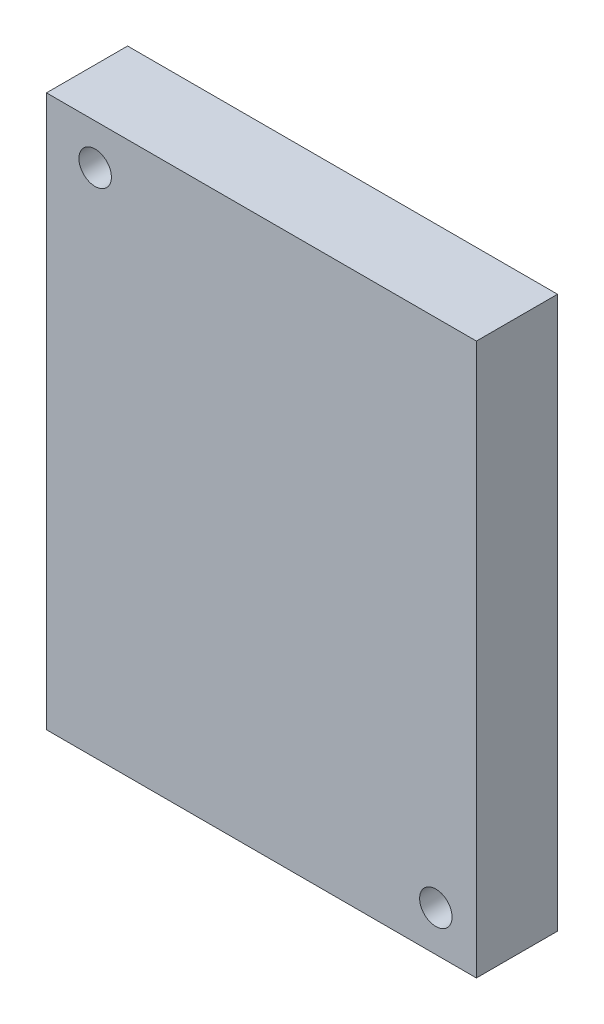
from build123d import *

# Parameters (mm, degrees)
SKETCH1_W           = 26.5
SKETCH1_H           = 34
SKETCH1_R           = 1
BOSS_EXTRUDE1_DEPTH = 5


with BuildPart() as part:
    # Sketch1 → Boss-Extrude1 (new body)
    with BuildSketch(Plane.XY):
        with Locations((13.25, 17)):
            Rectangle(SKETCH1_W, SKETCH1_H)
        with Locations((3, 31.5)):
            Circle(SKETCH1_R, mode=Mode.SUBTRACT)
        with Locations((24, 2.5)):
            Circle(SKETCH1_R, mode=Mode.SUBTRACT)
    extrude(amount=BOSS_EXTRUDE1_DEPTH)


solid = part.part
